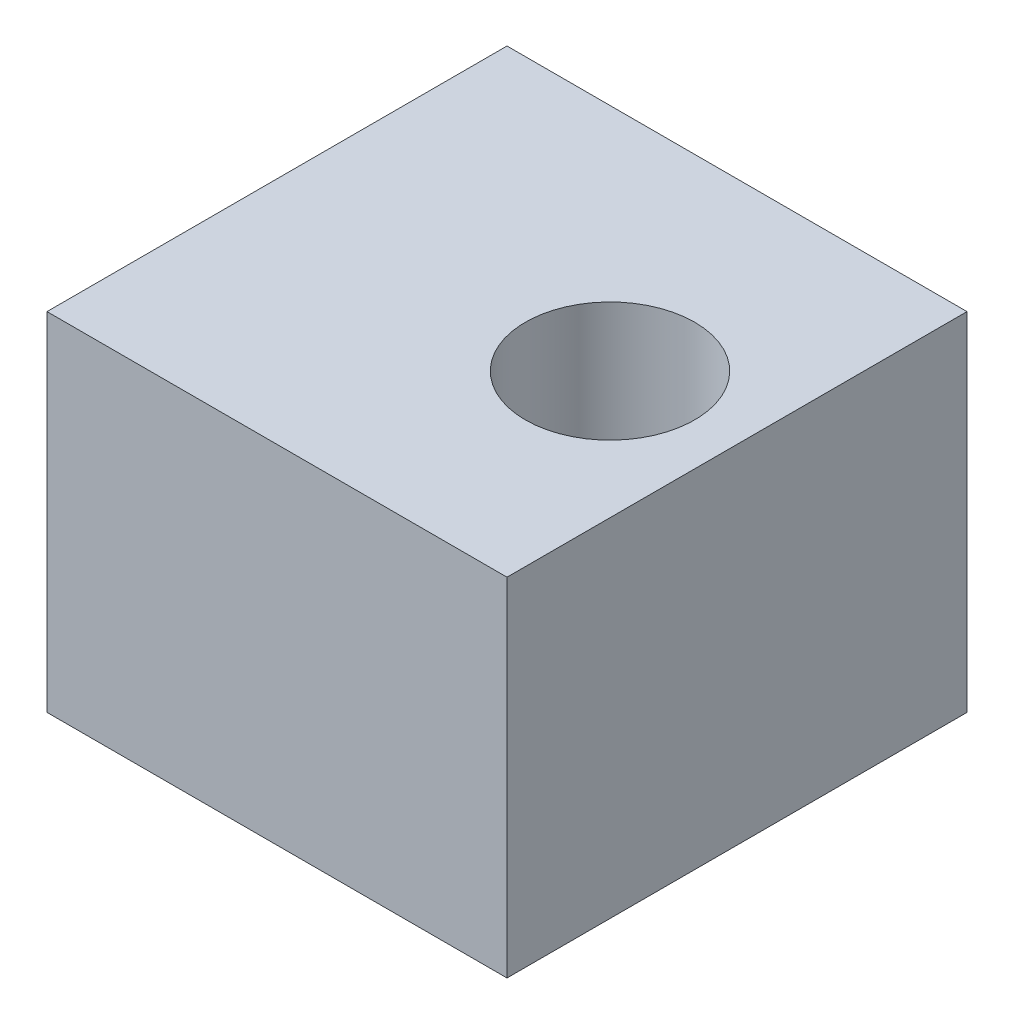
from build123d import *

# Parameters (mm, degrees)
SKETCH1_W           = 16.3
SKETCH1_H           = 16.3
BOSS_EXTRUDE1_DEPTH = 12.3
SKETCH2_R           = 3
CUT_EXTRUDE1_DEPTH  = 12.3


with BuildPart() as part:
    # Sketch1 → Boss-Extrude1 (new body)
    with BuildSketch(Plane(origin=(0, 0, 0), x_dir=(1, 0, 0), z_dir=(0, 1, 0))):
        Rectangle(SKETCH1_W, SKETCH1_H)
    extrude(amount=BOSS_EXTRUDE1_DEPTH)

    # Sketch2 → Cut-Extrude1 (cut)
    with BuildSketch(Plane(origin=(0, 0, 0), x_dir=(1, 0, 0), z_dir=(0, 1, 0))):
        with Locations(Location((3.65, 0, 0), (0, 0, 90))):
            Circle(SKETCH2_R)
    extrude(amount=CUT_EXTRUDE1_DEPTH, mode=Mode.SUBTRACT)


solid = part.part
